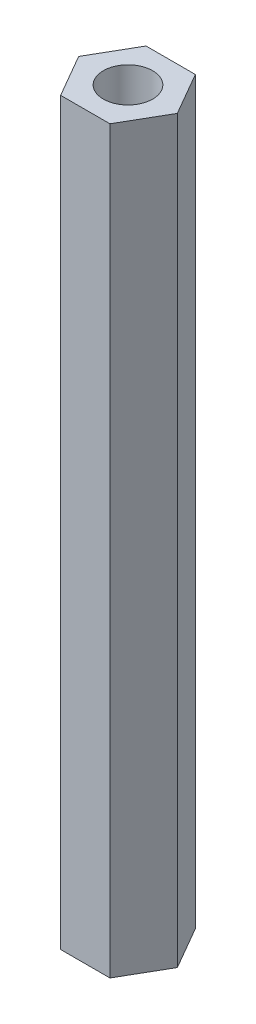
from build123d import *

# Parameters (mm, degrees)
EXTRUDE_1_DEPTH = 60


with BuildPart() as part:
    # 草图1 → 凸台-拉伸1 (new body)
    with BuildSketch(Plane(origin=(0, 0, 0), x_dir=(1, 0, 0), z_dir=(0, 1, 0))):
        with BuildLine():
            Line((2.09823197, 4.329567776), (-1.90176803, 4.329567776))
            Line((-1.90176803, 4.329567776), (-0.90176803, 2.597516968))
            ThreePointArc((-0.90176803, 2.597516968), (1.09823197, 2.597516968), (2.09823197, 0.865466161))
            Line((2.09823197, 0.865466161), (4.09823197, 0.865466161))
            Line((4.09823197, 0.865466161), (2.09823197, 4.329567776))
        make_face()
        with BuildLine():
            Line((-0.90176803, 2.597516968), (-1.90176803, 4.329567776))
            Line((-1.90176803, 4.329567776), (-3.90176803, 0.865466161))
            Line((-3.90176803, 0.865466161), (-1.90176803, 0.865466161))
            ThreePointArc((-1.90176803, 0.865466161), (-1.633818837, 1.865466161), (-0.90176803, 2.597516968))
        make_face()
        with BuildLine():
            Line((-1.90176803, 0.865466161), (-3.90176803, 0.865466161))
            Line((-3.90176803, 0.865466161), (-1.90176803, -2.598635455))
            Line((-1.90176803, -2.598635455), (2.09823197, -2.598635455))
            Line((2.09823197, -2.598635455), (1.09823197, -0.866584647))
            ThreePointArc((1.09823197, -0.866584647), (-0.90176803, -0.866584647), (-1.90176803, 0.865466161))
        make_face()
        with BuildLine():
            Line((2.09823197, -2.598635455), (4.09823197, 0.865466161))
            Line((4.09823197, 0.865466161), (2.09823197, 0.865466161))
            ThreePointArc((2.09823197, 0.865466161), (1.830282778, -0.134533839), (1.09823197, -0.866584647))
            Line((1.09823197, -0.866584647), (2.09823197, -2.598635455))
        make_face()
    extrude(amount=EXTRUDE_1_DEPTH)


solid = part.part
